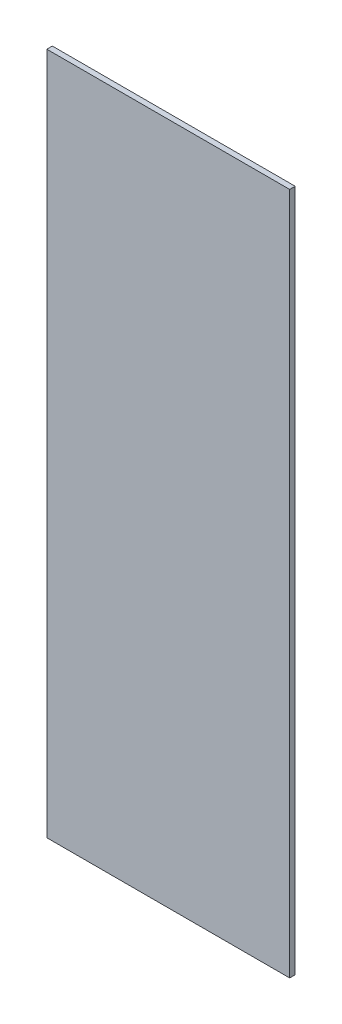
from build123d import *

# Parameters (mm, degrees)
SKETCH1_W           = 265
SKETCH1_H           = 745
BOSS_EXTRUDE1_DEPTH = 6


with BuildPart() as part:
    # Sketch1 → Boss-Extrude1 (new body)
    with BuildSketch(Plane.XY):
        Rectangle(SKETCH1_W, SKETCH1_H)
    extrude(amount=BOSS_EXTRUDE1_DEPTH)


solid = part.part
